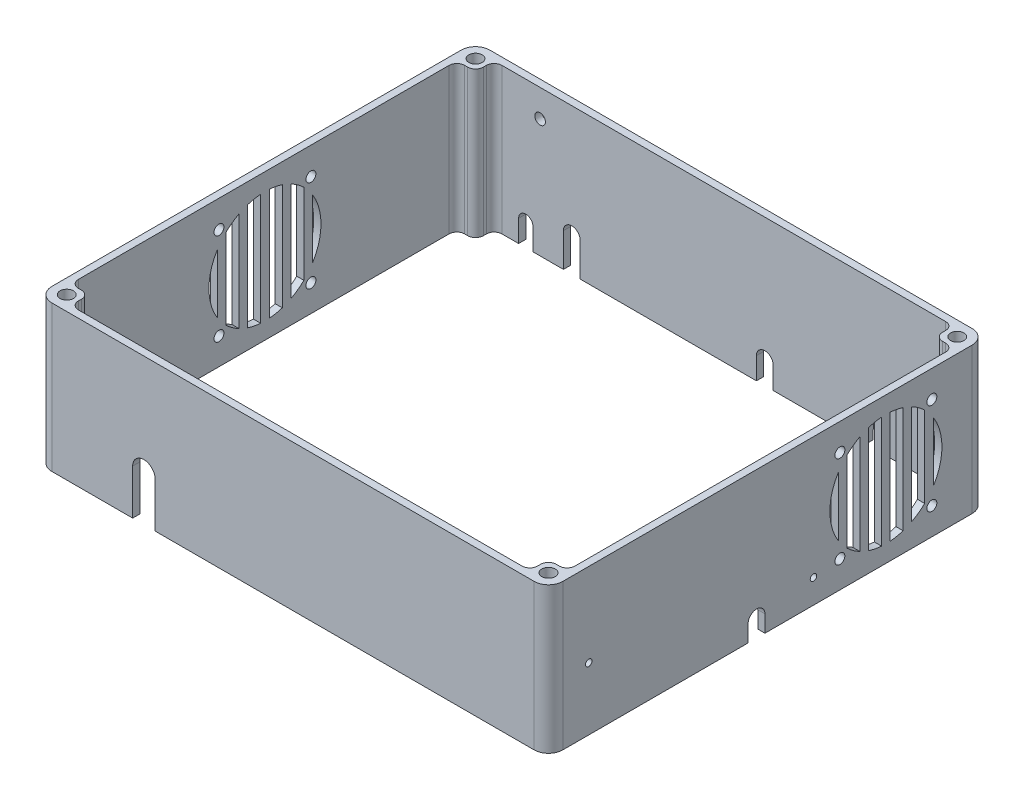
from build123d import *

# Parameters (mm, degrees)
BOSS_EXTRUDE1_DEPTH           = 55.88
SHELL1_T                      = -2.5
SKETCH3_W                     = 6.5
SKETCH3_H                     = 6.5
BOSS_EXTRUDE2_DEPTH           = 53.38
SKETCH35_R                    = 2.325
TOP_HOLES_DEPTH               = 10
SKETCH10_W                    = 177.8
SKETCH10_H                    = 5.08
CUT_BOTTOM_OFF_DEPTH          = 241.751270817
BOTTOM_START                  = 10
SKETCH17_R                    = 2.325
BOTTOM_OF_TOP_HOLES_DEPTH     = 10
CUT_FOR_ETHERNET_CABLE_REACH  = 341.742
KEYCARD_REACH                 = 236.911
FILLET1_R                     = 2.7
USB_B_REACH                   = 241.177
FILLET2_R                     = 5
SKETCH23_R                    = 1.73
RIGHTFAN_DEPTH                = 10
SKETCH36_R                    = 1.73
CUT_EXTRUDE1_DEPTH            = 10
CUT_EXTRUDE2_REACH            = 242.751
SKETCH42_R                    = 1.85
CUT_EXTRUDE3_REACH            = 242.751
TAP_DRILL_FOR_4_40_TAP1_D     = 2.2606
TAP_DRILL_FOR_4_40_TAP1_DEPTH = 2.5


with BuildPart() as part:
    # Sketch1 → Boss-Extrude1 (new body)
    with BuildSketch(Plane(origin=(0, 0, 0), x_dir=(1, 0, 0), z_dir=(0, 1, 0))):
        Polygon((0, 0), (0, 146.05), (177.8, 146.05), (177.8, 0), (177.8, -6.35), (0, -6.35), align=None)
    extrude(amount=BOSS_EXTRUDE1_DEPTH)

    # Shell1
    shell1_openings = [part.faces().sort_by_distance(p)[0] for p in [
        (88.9, 55.88, -69.85),
    ]]
    offset(amount=SHELL1_T, openings=shell1_openings, kind=Kind.INTERSECTION)

    # Sketch3 → Boss-Extrude2 (add)
    with BuildSketch(Plane(origin=(0, 55.88, 0), x_dir=(1, 0, 0), z_dir=(0, 1, 0))):
        with Locations((5.75, 140.3)):
            Rectangle(SKETCH3_W, SKETCH3_H)
        with Locations((172.05, 140.3)):
            Rectangle(SKETCH3_W, SKETCH3_H)
        with Locations((172.05, -0.6)):
            Rectangle(SKETCH3_W, SKETCH3_H)
        with Locations((5.75, -0.6)):
            Rectangle(SKETCH3_W, SKETCH3_H)
    extrude(amount=-BOSS_EXTRUDE2_DEPTH)

    # Sketch35 → Top holes (cut)
    with BuildSketch(Plane(origin=(0, 55.88, -60.96), x_dir=(-1, 0, 0), z_dir=(0, 1, 0))):
        with Locations(Location((-172.72, 62.23, 0), (0, 0, 90))):
            Circle(SKETCH35_R)
        with Locations(Location((-5.08, 62.23, 0), (0, 0, 90))):
            Circle(SKETCH35_R)
        with Locations(Location((-172.72, -80.01, 0), (0, 0, 90))):
            Circle(SKETCH35_R)
        with Locations(Location((-5.08, -80.01, 0), (0, 0, 90))):
            Circle(SKETCH35_R)
    extrude(amount=-TOP_HOLES_DEPTH, mode=Mode.SUBTRACT)

    # Sketch10 → cut Bottom off (cut, through all)
    with BuildSketch(Plane.XY.offset(6.35)):
        with Locations((88.9, 2.54)):
            Rectangle(SKETCH10_W, SKETCH10_H)
    extrude(amount=-CUT_BOTTOM_OFF_DEPTH, mode=Mode.SUBTRACT)

    # Sketch17 → Bottom of Top holes (cut)
    with BuildSketch(Plane(origin=(0, 5.08, 5.08), x_dir=(1, 0, 0), z_dir=(0, 1, 0)).offset(BOTTOM_START)):
        with Locations(Location((5.08, 146.05, 0), (0, 0, 270))):
            Circle(SKETCH17_R)
        with Locations(Location((172.72, 146.05, 0), (0, 0, 270))):
            Circle(SKETCH17_R)
        with Locations(Location((5.08, 3.81, 0), (0, 0, 270))):
            Circle(SKETCH17_R)
        with Locations(Location((172.72, 3.81, 0), (0, 0, 270))):
            Circle(SKETCH17_R)
    extrude(amount=-BOTTOM_OF_TOP_HOLES_DEPTH, mode=Mode.SUBTRACT)

    # Sketch12 → cut for Ethernet Cable (cut, up to next)
    with BuildSketch(Plane(origin=(299.72, 0, -143.55), x_dir=(1, 0, 0), z_dir=(0, 0, 1)), mode=Mode.PRIVATE) as cut_for_ethernet_cable_sk1:
        with BuildLine():
            Line((-155.386614113, 11.683999534), (-155.386614113, 5.08))
            Line((-155.386614113, 5.08), (-161.386614113, 5.08))
            Line((-161.386614113, 5.08), (-161.227787203, 11.753498622))
            ThreePointArc((-161.227787203, 11.753498622), (-158.272862109, 14.604792799), (-155.386614113, 11.683999534))
        make_face()
    cut_for_ethernet_cable_tool1 = extrude(cut_for_ethernet_cable_sk1.sketch, amount=-CUT_FOR_ETHERNET_CABLE_REACH, mode=Mode.PRIVATE) & part.part
    add(cut_for_ethernet_cable_tool1.solids().sort_by_distance((141.382684, 9.530384, -143.55))[0], mode=Mode.SUBTRACT)

    # Sketch16 → Keycard (cut, up to next)
    with BuildSketch(Plane.ZY.offset(-175.3), mode=Mode.PRIVATE) as keycard_sk1:
        with BuildLine():
            Line((-63.129, 10.922), (-63.129, 5.08))
            Line((-63.129, 5.08), (-68.971, 5.08))
            Line((-68.971, 5.08), (-68.971, 10.922))
            ThreePointArc((-68.971, 10.922), (-66.05, 13.843), (-63.129, 10.922))
        make_face()
    keycard_tool1 = extrude(keycard_sk1.sketch, amount=-KEYCARD_REACH, mode=Mode.PRIVATE) & part.part
    add(keycard_tool1.solids().sort_by_distance((175.3, 9.174195, -66.05))[0], mode=Mode.SUBTRACT)

    # Fillet1
    fillet1_edges = [part.edges().sort_by_distance(p)[0] for p in [
        (168.8, 30.48, -2.65),
        (175.3, 30.48, -2.65),
        (168.8, 30.48, 3.85),
        (9, 30.48, -2.65),
        (9, 30.48, 3.85),
        (2.5, 30.48, -2.65),
        (168.8, 30.48, -137.05),
        (168.8, 30.48, -143.55),
        (175.3, 30.48, -137.05),
        (9, 30.48, -137.05),
        (2.5, 30.48, -137.05),
        (9, 30.48, -143.55),
    ]]
    fillet(fillet1_edges, radius=FILLET1_R)

    # Sketch13 → usb B (cut, up to next)
    with BuildSketch(Plane.XY.offset(-143.55), mode=Mode.PRIVATE) as usb_b_sk1:
        with BuildLine():
            Line((106.1, 12.7), (106.1, 5.08))
            Line((106.1, 5.08), (100.258, 5.08))
            Line((100.258, 5.08), (100.258, 12.7))
            ThreePointArc((100.258, 12.7), (103.179, 15.621), (106.1, 12.7))
        make_face()
    usb_b_tool1 = extrude(usb_b_sk1.sketch, amount=-USB_B_REACH, mode=Mode.PRIVATE) & part.part
    # Sketch13 → usb B (cut, up to next)
    with BuildSketch(Plane.XY.offset(-143.55), mode=Mode.PRIVATE) as usb_b_sk2:
        with BuildLine():
            Line((38.938681111, 16.76), (38.938681111, 5.08))
            Line((38.938681111, 5.08), (33.096681111, 5.08))
            Line((33.096681111, 5.08), (33.096681111, 16.76))
            ThreePointArc((33.096681111, 16.76), (36.017681111, 19.681), (38.938681111, 16.76))
        make_face()
    usb_b_tool2 = extrude(usb_b_sk2.sketch, amount=-USB_B_REACH, mode=Mode.PRIVATE) & part.part
    # Sketch13 → usb B (cut, up to next)
    with BuildSketch(Plane.XY.offset(-143.55), mode=Mode.PRIVATE) as usb_b_sk3:
        with BuildLine():
            Line((22.5, 12.7), (22.5, 5.08))
            Line((22.5, 5.08), (17.5, 5.08))
            Line((17.5, 5.08), (17.5, 12.7))
            ThreePointArc((17.5, 12.7), (20, 15.2), (22.5, 12.7))
        make_face()
    usb_b_tool3 = extrude(usb_b_sk3.sketch, amount=-USB_B_REACH, mode=Mode.PRIVATE) & part.part
    add(usb_b_tool1.solids().sort_by_distance((103.179, 10.05851, -143.55))[0], mode=Mode.SUBTRACT)
    add(usb_b_tool2.solids().sort_by_distance((36.017681, 12.082282, -143.55))[0], mode=Mode.SUBTRACT)
    add(usb_b_tool3.solids().sort_by_distance((20, 9.887992, -143.55))[0], mode=Mode.SUBTRACT)

    # Fillet2
    fillet2_edges = [part.edges().sort_by_distance(p)[0] for p in [
        (0, 30.48, -146.05),
        (177.8, 30.48, -146.05),
        (177.8, 30.48, 6.35),
        (0, 30.48, 6.35),
    ]]
    fillet(fillet2_edges, radius=FILLET2_R)

    # Sketch23 → RightFan (cut)
    with BuildSketch(Plane(origin=(177.8, 0, -323.85), x_dir=(0, 0, 1), z_dir=(-1, 0, 0))):
        with BuildLine():
            Line((206.8, 49.033975315), (206.8, 30.48))
            Line((206.8, 30.48), (211.3, 30.48))
            Line((211.3, 30.48), (211.3, 49.922222095))
            ThreePointArc((211.3, 49.922222095), (209.023792169, 49.610871763), (206.8, 49.033975315))
        make_face()
        with BuildLine():
            Line((211.3, 30.48), (206.8, 30.48))
            Line((206.8, 30.48), (206.8, 11.926024685))
            ThreePointArc((206.8, 11.926024685), (209.023792169, 11.349128237), (211.3, 11.037777905))
            Line((211.3, 11.037777905), (211.3, 30.48))
        make_face()
        with BuildLine():
            Line((199.3, 44.551247279), (199.3, 30.48))
            Line((199.3, 30.48), (203.8, 30.48))
            Line((203.8, 30.48), (203.8, 47.778843892))
            ThreePointArc((203.8, 47.778843892), (201.434840741, 46.32560365), (199.3, 44.551247279))
        make_face()
        with BuildLine():
            Line((203.8, 30.48), (199.3, 30.48))
            Line((199.3, 30.48), (199.3, 16.408752721))
            ThreePointArc((199.3, 16.408752721), (201.434840741, 14.63439635), (203.8, 13.181156108))
            Line((203.8, 13.181156108), (203.8, 30.48))
        make_face()
        with BuildLine():
            ThreePointArc((196.3, 40.872304845), (194.065006005, 35.888326913), (193.3, 30.48))
            Line((193.3, 30.48), (196.3, 30.48))
            Line((196.3, 30.48), (196.3, 40.872304845))
        make_face()
        with BuildLine():
            Line((196.3, 30.48), (193.3, 30.48))
            ThreePointArc((193.3, 30.48), (194.065006005, 25.071673087), (196.3, 20.087695155))
            Line((196.3, 20.087695155), (196.3, 30.48))
        make_face()
        with BuildLine():
            ThreePointArc((218.825109069, 49.025836749), (216.589154694, 49.608311653), (214.3, 49.922222095))
            Line((214.3, 49.922222095), (214.3, 11.037777905))
            ThreePointArc((214.3, 11.037777905), (216.589154694, 11.351688347), (218.825109069, 11.934163251))
            Line((218.825109069, 11.934163251), (218.825109069, 49.025836749))
        make_face()
        with BuildLine():
            ThreePointArc((226.350218139, 44.50289515), (224.204951426, 46.296987165), (221.825109069, 47.765757325))
            Line((221.825109069, 47.765757325), (221.825109069, 13.194242675))
            ThreePointArc((221.825109069, 13.194242675), (224.204951426, 14.663012835), (226.350218139, 16.45710485))
            Line((226.350218139, 16.45710485), (226.350218139, 44.50289515))
        make_face()
        with BuildLine():
            ThreePointArc((232.3, 30.48), (231.548056615, 35.842869861), (229.350218139, 40.792142336))
            Line((229.350218139, 40.792142336), (229.350218139, 20.167857664))
            ThreePointArc((229.350218139, 20.167857664), (231.548056615, 25.117130139), (232.3, 30.48))
        make_face()
        with Locations((196.8, 14.48)):
            Circle(SKETCH23_R)
        with Locations((228.8, 14.48)):
            Circle(SKETCH23_R)
        with Locations((228.8, 46.48)):
            Circle(SKETCH23_R)
        with Locations((196.8, 46.48)):
            Circle(SKETCH23_R)
    extrude(amount=RIGHTFAN_DEPTH, mode=Mode.SUBTRACT)

    # Sketch36 → Cut-Extrude1 (cut)
    with BuildSketch(Plane(origin=(0, 0, 323.85), x_dir=(0, 0, -1), z_dir=(1, 0, 0))):
        with BuildLine():
            ThreePointArc((377.630185666, 40.76950847), (374.630185666, 30.377203624), (377.630185666, 19.984898779))
            Line((377.630185666, 19.984898779), (377.630185666, 40.76950847))
        make_face()
        with BuildLine():
            Line((380.630185666, 44.448450904), (380.630185666, 16.305956345))
            ThreePointArc((380.630185666, 16.305956345), (382.765026408, 14.531599974), (385.130185666, 13.078359732))
            Line((385.130185666, 13.078359732), (385.130185666, 47.676047516))
            ThreePointArc((385.130185666, 47.676047516), (382.765026408, 46.222807274), (380.630185666, 44.448450904))
        make_face()
        with Locations(Location((378.130185666, 46.377203624, 0), (0, 0, 180))):
            Circle(SKETCH36_R)
        with Locations(Location((378.130185666, 14.377203624, 0), (0, 0, 180))):
            Circle(SKETCH36_R)
        with BuildLine():
            Line((388.130185666, 48.931178939), (388.130185666, 11.823228309))
            ThreePointArc((388.130185666, 11.823228309), (390.353977835, 11.246331861), (392.630185666, 10.934981529))
            Line((392.630185666, 10.934981529), (392.630185666, 49.819425719))
            ThreePointArc((392.630185666, 49.819425719), (390.353977835, 49.508075387), (388.130185666, 48.931178939))
        make_face()
        with BuildLine():
            ThreePointArc((400.155294736, 48.923040373), (397.919340361, 49.505515277), (395.630185666, 49.819425719))
            Line((395.630185666, 49.819425719), (395.630185666, 10.934981529))
            ThreePointArc((395.630185666, 10.934981529), (397.919340361, 11.248891971), (400.155294736, 11.831366876))
            Line((400.155294736, 11.831366876), (400.155294736, 48.923040373))
        make_face()
        with BuildLine():
            ThreePointArc((407.680403805, 44.400098775), (405.535137092, 46.194190789), (403.155294736, 47.662960949))
            Line((403.155294736, 47.662960949), (403.155294736, 13.0914463))
            ThreePointArc((403.155294736, 13.0914463), (405.535137092, 14.560216459), (407.680403805, 16.354308474))
            Line((407.680403805, 16.354308474), (407.680403805, 44.400098775))
        make_face()
        with BuildLine():
            ThreePointArc((410.680403805, 20.065061288), (413.630185666, 30.377203624), (410.680403805, 40.689345961))
            Line((410.680403805, 40.689345961), (410.680403805, 20.065061288))
        make_face()
        with Locations(Location((410.130185666, 46.377203624, 0), (0, 0, 180))):
            Circle(SKETCH36_R)
        with Locations(Location((410.130185666, 14.377203624, 0), (0, 0, 180))):
            Circle(SKETCH36_R)
    extrude(amount=CUT_EXTRUDE1_DEPTH, mode=Mode.SUBTRACT)

    # Sketch42 → Cut-Extrude2 (cut, up to next)
    with BuildSketch(Plane(origin=(0, 0, -146.05), x_dir=(-1, 0, 0), z_dir=(0, 0, -1)), mode=Mode.PRIVATE) as cut_extrude2_sk1:
        with Locations((-24.982804036, 46.375)):
            Circle(SKETCH42_R)
    cut_extrude2_tool1 = extrude(cut_extrude2_sk1.sketch, amount=-CUT_EXTRUDE2_REACH, mode=Mode.PRIVATE) & part.part
    add(cut_extrude2_tool1.solids().sort_by_distance((24.982804, 46.375, -146.05))[0], mode=Mode.SUBTRACT)

    # Sketch43 → Cut-Extrude3 (cut, up to next)
    with BuildSketch(Plane.XY.offset(6.35), mode=Mode.PRIVATE) as cut_extrude3_sk1:
        with BuildLine():
            Line((40.896681111, 5.08), (40.896681111, 20.779999344))
            ThreePointArc((40.896681111, 20.779999344), (36.996681111, 24.68), (33.096681111, 20.779999344))
            Line((33.096681111, 20.779999344), (33.096681111, 5.08))
            Line((33.096681111, 5.08), (40.896681111, 5.08))
        make_face()
    cut_extrude3_tool1 = extrude(cut_extrude3_sk1.sketch, amount=-CUT_EXTRUDE3_REACH, mode=Mode.PRIVATE) & part.part
    add(cut_extrude3_tool1.solids().sort_by_distance((36.996681, 14.481718, 6.35))[0], mode=Mode.SUBTRACT)

    # Tap Drill for #4-40 Tap1
    with Locations(Plane(origin=(177.8, 26.83, -7.65), x_dir=(0, 0, 1), z_dir=(1, 0, 0))):
        with Locations((0, 0), (-78.210373353, 13.4)):
            Hole(TAP_DRILL_FOR_4_40_TAP1_D / 2, depth=TAP_DRILL_FOR_4_40_TAP1_DEPTH)


solid = part.part
